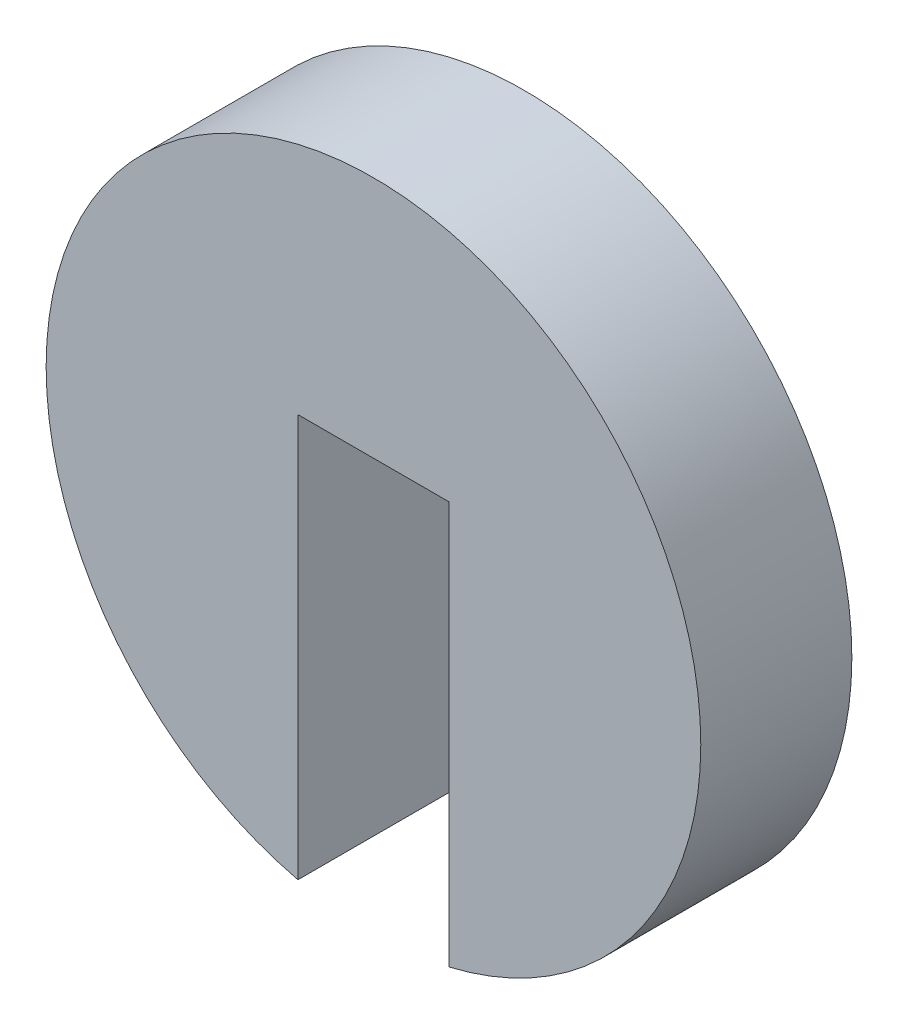
from build123d import *

# Parameters (mm, degrees)
BASE_EXTRUDE_DEPTH = 3


with BuildPart() as part:
    # Sketch1 → Base-Extrude (new body)
    with BuildSketch(Plane.XY):
        with BuildLine():
            Line((0, 1.67544468), (1.5, 1.67544468))
            Line((1.5, 1.67544468), (1.5, -6.32455532))
            ThreePointArc((1.5, -6.32455532), (0, 6.5), (-1.5, -6.32455532))
            Line((-1.5, -6.32455532), (-1.5, 1.67544468))
            Line((-1.5, 1.67544468), (0, 1.67544468))
        make_face()
    extrude(amount=BASE_EXTRUDE_DEPTH)


solid = part.part
